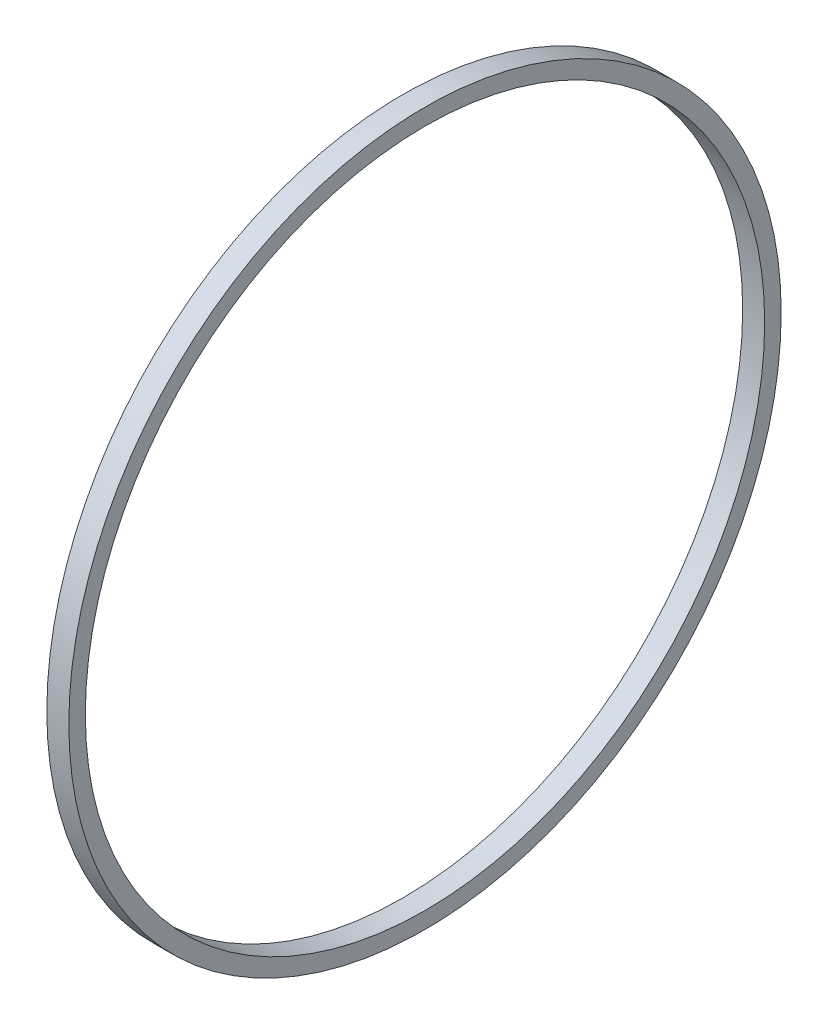
from build123d import *

# Parameters (mm, degrees)
SKETCH1_W = 6.35
SKETCH1_H = 4.7625


with BuildPart() as part:
    # Sketch1 → Revolve1 (revolve)
    with BuildSketch(Plane.XY, mode=Mode.PRIVATE) as revolve1_sk:
        with Locations((0, 100.38125)):
            Rectangle(SKETCH1_W, SKETCH1_H)
    revolve(revolve1_sk.sketch.rotate(Axis((0, 0, 0), (1, 0, 0)), 90), axis=Axis((0, 0, 0), (1, 0, 0)))


solid = part.part
